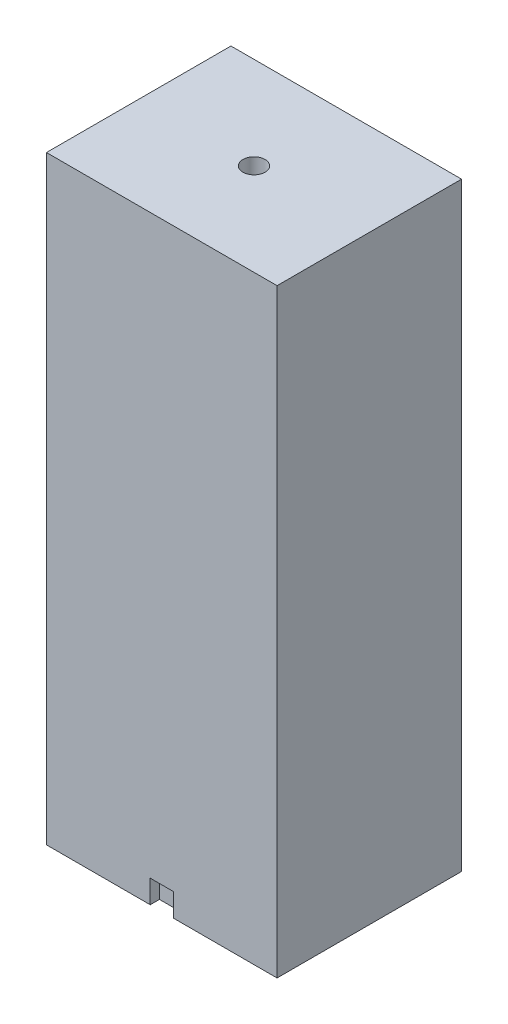
from build123d import *

# Parameters (mm, degrees)
SKETCH1_W           = 63.5
SKETCH1_H           = 165.1
BOSS_EXTRUDE1_DEPTH = 50.8
SKETCH2_R           = 3.048
BOSS_EXTRUDE2_DEPTH = 5.08
SKETCH3_R           = 3.048
CUT_EXTRUDE1_DEPTH  = 6.35
SKETCH4_W           = 6.35
SKETCH4_H           = 6.35
CUT_EXTRUDE2_DEPTH  = 2.54


with BuildPart() as part:
    # Sketch1 → Boss-Extrude1 (new body)
    with BuildSketch(Plane.XY):
        with Locations((31.75, 82.55)):
            Rectangle(SKETCH1_W, SKETCH1_H)
    extrude(amount=BOSS_EXTRUDE1_DEPTH)

    # Sketch2 → Boss-Extrude2 (add)
    with BuildSketch(Plane.XZ):
        with Locations(Location((31.75, 25.4, 0), (0, 0, 90))):
            Circle(SKETCH2_R)
    extrude(amount=BOSS_EXTRUDE2_DEPTH)

    # Sketch3 → Cut-Extrude1 (cut)
    with BuildSketch(Plane(origin=(0, 165.1, 0), x_dir=(1, 0, 0), z_dir=(0, 1, 0))):
        with Locations(Location((31.75, -25.4, 0), (0, 0, 270))):
            Circle(SKETCH3_R)
    extrude(amount=-CUT_EXTRUDE1_DEPTH, mode=Mode.SUBTRACT)

    # Sketch4 → Cut-Extrude2 (cut)
    with BuildSketch(Plane.XY.offset(50.8)):
        with Locations((31.75, 3.175)):
            Rectangle(SKETCH4_W, SKETCH4_H)
    extrude(amount=-CUT_EXTRUDE2_DEPTH, mode=Mode.SUBTRACT)


solid = part.part
